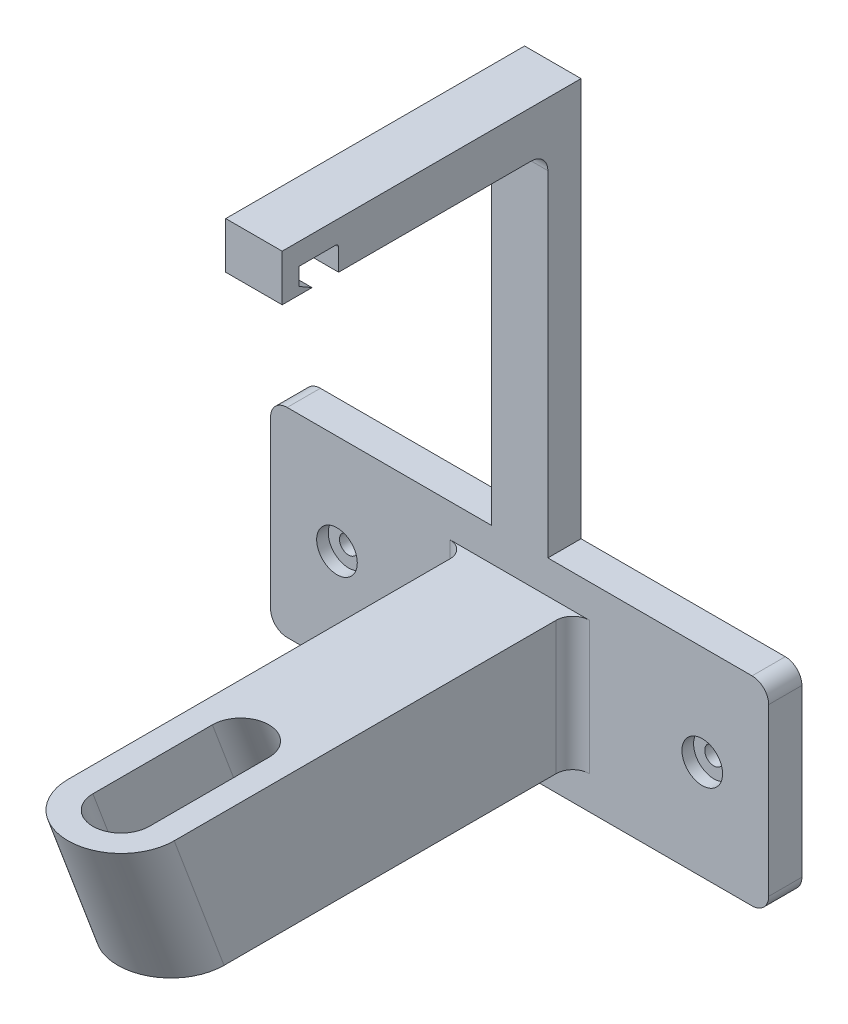
from build123d import *

# Parameters (mm, degrees)
SKETCH1_W                               = 150
SKETCH1_H                               = 60
BOSS_EXTRUDE1_DEPTH                     = 10
CBORE_FOR_M5_HEX_HEAD_BOLT1_D           = 5.5
CBORE_FOR_M5_HEX_HEAD_BOLT1_CBORE_D     = 12.238
CBORE_FOR_M5_HEX_HEAD_BOLT1_CBORE_DEPTH = 3.5
SKETCH4_W                               = 32
SKETCH4_H                               = 40
BOSS_EXTRUDE2_DEPTH                     = 120
CUT_EXTRUDE1_DEPTH                      = 120
BOSS_EXTRUDE3_DEPTH                     = 42.720018727
CUT_EXTRUDE2_DEPTH                      = 45.625
SKETCH10_W                              = 17
SKETCH10_H                              = 10
BOSS_EXTRUDE4_DEPTH                     = 120
SKETCH11_W                              = 17
SKETCH11_H                              = 14
BOSS_EXTRUDE5_DEPTH                     = 80
CUT_EXTRUDE3_DEPTH                      = 95
FILLET1_R                               = 5
FILLET2_R                               = 5
FILLET3_R                               = 5
FILLET4_R                               = 1


with BuildPart() as part:
    # Sketch1 → Boss-Extrude1 (new body)
    with BuildSketch(Plane.XY):
        Rectangle(SKETCH1_W, SKETCH1_H)
    extrude(amount=BOSS_EXTRUDE1_DEPTH)

    # CBORE for M5 Hex Head Bolt1 (through all)
    with Locations(Plane(origin=(-55, 0, 10), x_dir=(1, 0, 0), z_dir=(0, 0, 1))):
        with Locations((0, 0), (110, 0)):
            CounterBoreHole(CBORE_FOR_M5_HEX_HEAD_BOLT1_D / 2, CBORE_FOR_M5_HEX_HEAD_BOLT1_CBORE_D / 2, CBORE_FOR_M5_HEX_HEAD_BOLT1_CBORE_DEPTH)

    # Sketch4 → Boss-Extrude2 (add)
    with BuildSketch(Plane.XY.offset(10)):
        Rectangle(SKETCH4_W, SKETCH4_H)
    extrude(amount=BOSS_EXTRUDE2_DEPTH)

    # Sketch7 → Cut-Extrude1 (cut)
    with BuildSketch(Plane(origin=(16, 0, 0), x_dir=(0, 0, -1), z_dir=(1, 0, 0))):
        Polygon((-130, 20), (-115, -20), (-130, -20), align=None)
    extrude(amount=-CUT_EXTRUDE1_DEPTH, mode=Mode.SUBTRACT)

    # Sketch8 → Boss-Extrude3 (add, along a direction that is not the sketch's normal)
    with BuildSketch(Plane(origin=(0, 20, 0), x_dir=(1, 0, 0), z_dir=(0, 1, 0))):
        with BuildLine():
            Line((-16, -130), (16, -130))
            ThreePointArc((16, -130), (0, -146), (-16, -130))
        make_face()
    extrude(amount=-BOSS_EXTRUDE3_DEPTH, dir=(0, 0.9363291775690444, 0.351123441588392))

    # Sketch9 → Cut-Extrude2 (cut, along a direction that is not the sketch's normal)
    with BuildSketch(Plane(origin=(0, 20, 0), x_dir=(1, 0, 0), z_dir=(0, 1, 0))):
        with BuildLine():
            Line((8.5, -94), (8.5, -130))
            ThreePointArc((8.5, -130), (0, -138.5), (-8.5, -130))
            Line((-8.5, -130), (-8.5, -94))
            ThreePointArc((-8.5, -94), (0, -85.5), (8.5, -94))
        make_face()
    extrude(amount=-CUT_EXTRUDE2_DEPTH, dir=(0, 0.9363291775690444, 0.351123441588392), mode=Mode.SUBTRACT)

    # Sketch10 → Boss-Extrude4 (add)
    with BuildSketch(Plane(origin=(0, 30, 0), x_dir=(1, 0, 0), z_dir=(0, 1, 0))):
        with Locations((0, -5)):
            Rectangle(SKETCH10_W, SKETCH10_H)
    extrude(amount=BOSS_EXTRUDE4_DEPTH)

    # Sketch11 → Boss-Extrude5 (add)
    with BuildSketch(Plane.XY.offset(10)):
        with Locations((0, 143)):
            Rectangle(SKETCH11_W, SKETCH11_H)
    extrude(amount=BOSS_EXTRUDE5_DEPTH)

    # Sketch13 → Cut-Extrude3 (cut)
    with BuildSketch(Plane(origin=(8.5, 0, 0), x_dir=(0, 0, -1), z_dir=(1, 0, 0))):
        Polygon((-85, 143.5), (-85, 138.309401077), (-81, 136), (-73, 136), (-73, 143.5), align=None)
    extrude(amount=-CUT_EXTRUDE3_DEPTH, mode=Mode.SUBTRACT)

    # Fillet1
    fillet1_edges = [part.edges().sort_by_distance(p)[0] for p in [
        (0, 136, 10),
    ]]
    fillet(fillet1_edges, radius=FILLET1_R)

    # Fillet2
    fillet2_edges = [part.edges().sort_by_distance(p)[0] for p in [
        (75, -30, 5),
        (-75, -30, 5),
        (-75, 30, 5),
        (75, 30, 5),
    ]]
    fillet(fillet2_edges, radius=FILLET2_R)

    # Fillet3
    fillet3_edges = [part.edges().sort_by_distance(p)[0] for p in [
        (16, 0, 10),
        (-16, 0, 10),
    ]]
    fillet(fillet3_edges, radius=FILLET3_R)

    # Fillet4
    fillet4_edges = [part.edges().sort_by_distance(p)[0] for p in [
        (0, 143.5, 73),
    ]]
    fillet(fillet4_edges, radius=FILLET4_R)


solid = part.part
